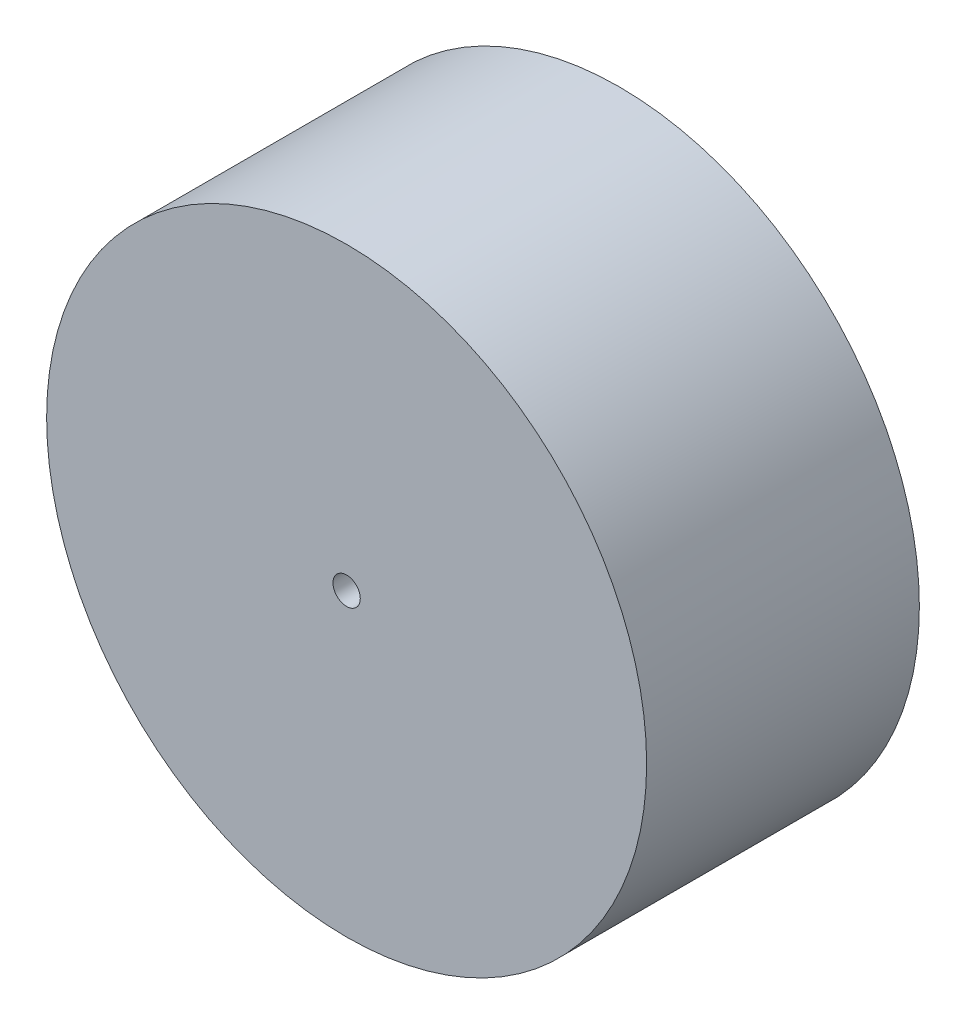
from build123d import *

# Parameters (mm, degrees)
BOSS_EXTRUDE1_DEPTH      = 63.5
BOSS_EXTRUDE1_DEPTH_BACK = 63.5
SKETCH2_R                = 139.7
SKETCH3_R                = 6.35
CUT_EXTRUDE1_DEPTH       = 235.864173513


with BuildPart() as part:
    # Sketch2 → Boss-Extrude1 (new, two sides: drawn at the far end of the back side and taken through both)
    with BuildSketch(Plane.XY.offset(-BOSS_EXTRUDE1_DEPTH_BACK)):
        Circle(SKETCH2_R)
    extrude(amount=BOSS_EXTRUDE1_DEPTH + BOSS_EXTRUDE1_DEPTH_BACK)

    # Sketch3 → Cut-Extrude1 (cut, through all)
    with BuildSketch(Plane.XY.offset(63.5)):
        Circle(SKETCH3_R)
    extrude(amount=-CUT_EXTRUDE1_DEPTH, mode=Mode.SUBTRACT)


solid = part.part
